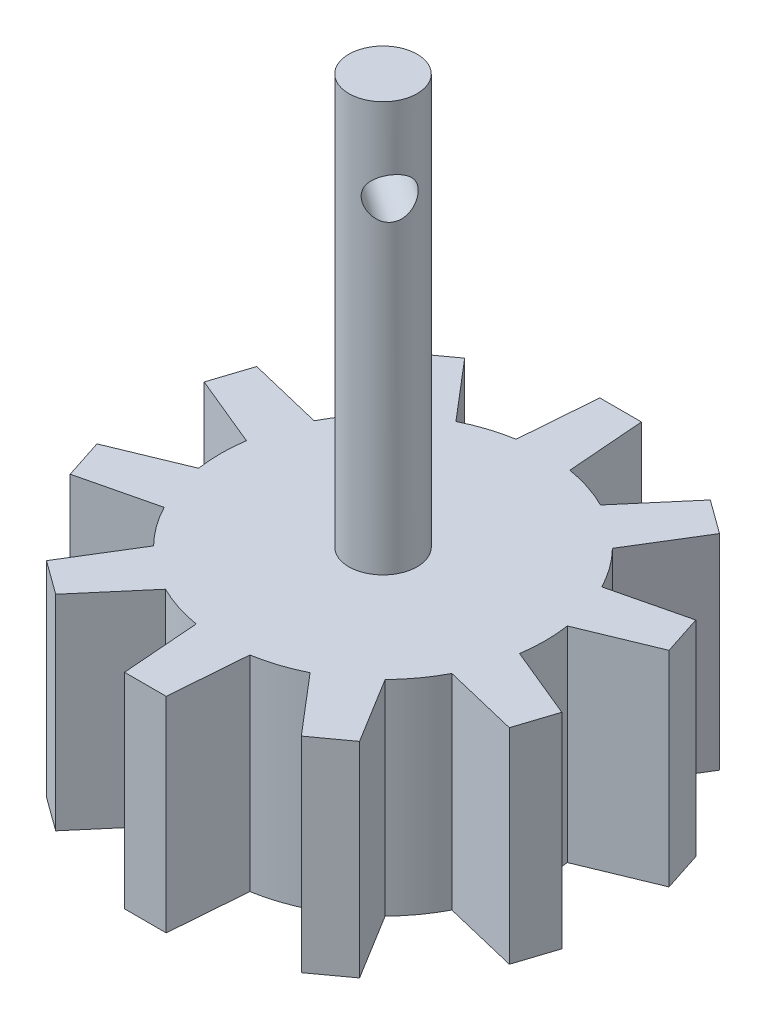
from build123d import *

# Parameters (mm, degrees)
SKETCH1_R           = 4.75
GEAR_ROOT_DEPTH     = 6
SKETCH3_R           = 1
NEEDLE_SHAFT_DEPTH  = 18
BOSS_EXTRUDE1_DEPTH = 6
SKETCH7_R           = 0.6
CUT_EXTRUDE1_DEPTH  = 10


with BuildPart() as part:
    # Sketch1 → GEAR_ROOT (new body)
    with BuildSketch(Plane(origin=(0, 0, 0), x_dir=(1, 0, 0), z_dir=(0, 1, 0))):
        with Locations(Location((0, 0, 0), (0, 0, 270))):
            Circle(SKETCH1_R)
    extrude(amount=GEAR_ROOT_DEPTH)

    # Sketch3 → NEEDLE_SHAFT (add)
    with BuildSketch(Plane(origin=(0, 0, 0), x_dir=(1, 0, 0), z_dir=(0, 1, 0))):
        with Locations(Location((0, 0, 0), (0, 0, 270))):
            Circle(SKETCH3_R)
    extrude(amount=NEEDLE_SHAFT_DEPTH)

    # Sketch6 → Boss-Extrude1 (add)
    with BuildSketch(Plane.XZ):
        with BuildLine():
            Line((0.61, 6.95761567), (-0.61, 6.95761567))
            Line((-0.61, 6.95761567), (-0.786402192, 4.684449978))
            ThreePointArc((-0.786402192, 4.684449978), (0, 4.75), (0.786402192, 4.684449978))
            Line((0.786402192, 4.684449978), (0.61, 6.95761567))
        make_face()
        with BuildLine():
            Line((4.583084249, 5.270280314), (3.596083516, 5.987378321))
            Line((3.596083516, 5.987378321), (2.117237874, 4.252035252))
            ThreePointArc((2.117237874, 4.252035252), (2.791979948, 3.842830723), (3.38966335, 3.32756403))
            Line((3.38966335, 3.32756403), (4.583084249, 5.270280314))
        make_face()
        with BuildLine():
            Line((6.805586088, 1.569877008), (6.428585355, 2.730165957))
            Line((6.428585355, 2.730165957), (4.212165035, 2.195487582))
            ThreePointArc((4.212165035, 2.195487582), (4.517518452, 1.467830723), (4.698188318, 0.699661723))
            Line((4.698188318, 0.699661723), (6.805586088, 1.569877008))
        make_face()
        with BuildLine():
            Line((6.428585355, -2.730165957), (6.805586088, -1.569877008))
            Line((6.805586088, -1.569877008), (4.698188318, -0.699661723))
            ThreePointArc((4.698188318, -0.699661723), (4.517518452, -1.467830723), (4.212165035, -2.195487582))
            Line((4.212165035, -2.195487582), (6.428585355, -2.730165957))
        make_face()
        with BuildLine():
            Line((3.596083516, -5.987378321), (4.583084249, -5.270280314))
            Line((4.583084249, -5.270280314), (3.38966335, -3.32756403))
            ThreePointArc((3.38966335, -3.32756403), (2.791979948, -3.842830723), (2.117237874, -4.252035252))
            Line((2.117237874, -4.252035252), (3.596083516, -5.987378321))
        make_face()
        with BuildLine():
            Line((-0.61, -6.95761567), (0.61, -6.95761567))
            Line((0.61, -6.95761567), (0.786402192, -4.684449978))
            ThreePointArc((0.786402192, -4.684449978), (0, -4.75), (-0.786402192, -4.684449978))
            Line((-0.786402192, -4.684449978), (-0.61, -6.95761567))
        make_face()
        with BuildLine():
            Line((-4.583084249, -5.270280314), (-3.596083516, -5.987378321))
            Line((-3.596083516, -5.987378321), (-2.117237874, -4.252035252))
            ThreePointArc((-2.117237874, -4.252035252), (-2.791979948, -3.842830723), (-3.38966335, -3.32756403))
            Line((-3.38966335, -3.32756403), (-4.583084249, -5.270280314))
        make_face()
        with BuildLine():
            Line((-6.805586088, -1.569877008), (-6.428585355, -2.730165957))
            Line((-6.428585355, -2.730165957), (-4.212165035, -2.195487582))
            ThreePointArc((-4.212165035, -2.195487582), (-4.517518452, -1.467830723), (-4.698188318, -0.699661723))
            Line((-4.698188318, -0.699661723), (-6.805586088, -1.569877008))
        make_face()
        with BuildLine():
            Line((-6.428585355, 2.730165957), (-6.805586088, 1.569877008))
            Line((-6.805586088, 1.569877008), (-4.698188318, 0.699661723))
            ThreePointArc((-4.698188318, 0.699661723), (-4.517518452, 1.467830723), (-4.212165035, 2.195487582))
            Line((-4.212165035, 2.195487582), (-6.428585355, 2.730165957))
        make_face()
        with BuildLine():
            Line((-3.596083516, 5.987378321), (-4.583084249, 5.270280314))
            Line((-4.583084249, 5.270280314), (-3.38966335, 3.32756403))
            ThreePointArc((-3.38966335, 3.32756403), (-2.791979948, 3.842830723), (-2.117237874, 4.252035252))
            Line((-2.117237874, 4.252035252), (-3.596083516, 5.987378321))
        make_face()
    extrude(amount=-BOSS_EXTRUDE1_DEPTH)

    # Sketch7 → Cut-Extrude1 (cut)
    with BuildSketch(Plane(origin=(1.228784274, 0, 0.860284377), x_dir=(0.5735229177482851, 0, -0.8191895158127294), z_dir=(0.8191895158127294, 0, 0.5735229177482851))):
        with Locations((0, 15.53461336)):
            Circle(SKETCH7_R)
    extrude(amount=-CUT_EXTRUDE1_DEPTH, mode=Mode.SUBTRACT)


solid = part.part
